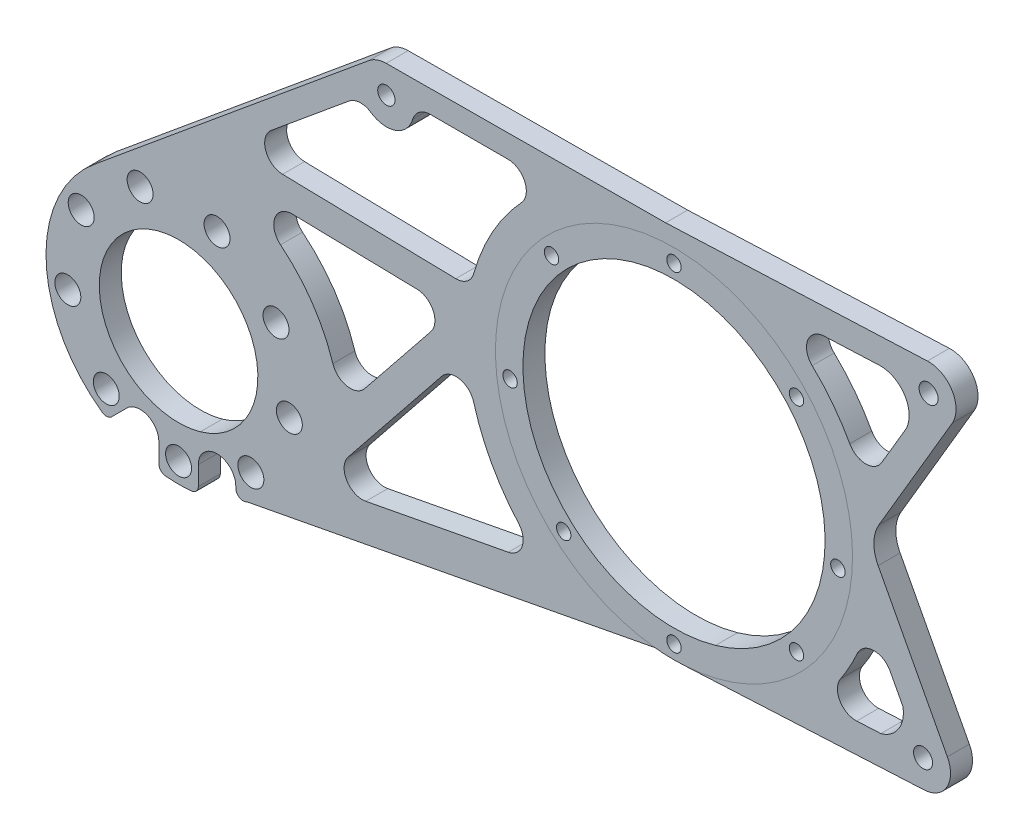
from build123d import *

# Parameters (mm, degrees)
SKETCH15_R          = 3.3
SKETCH15_R_2        = 2.5
SKETCH15_R_3        = 52.3875
SKETCH15_R_4        = 4.5
SKETCH15_R_5        = 27.4955
BOSS_EXTRUDE1_DEPTH = 7.62
SKETCH18_R          = 3.3
SKETCH18_R_2        = 3
PROFILE_DEPTH       = 804.110776731
PROF_FILLET_R       = 12.7
CUT_EXTRUDE2_DEPTH  = 784.912644787
FILLET2_R           = 6.35
CUT_EXTRUDE4_DEPTH  = 784.912644787
FILLET5_R           = 6.35


with BuildPart() as part:
    # Sketch15 → Boss-Extrude1 (new body)
    with BuildSketch(Plane(origin=(0, 0, 0), x_dir=(-1, 0, 0), z_dir=(0, 0, 1))):
        with BuildLine():
            ThreePointArc((-776.492771968, 151.978917225), (-781.907485254, 150.230614898), (-784.225, 145.034))
            Line((-784.225, 145.034), (-784.225, 0))
            ThreePointArc((-784.225, 0), (-782.179140867, -4.939140867), (-777.24, -6.985))
            Line((-777.24, -6.985), (-548.64, -6.985))
            ThreePointArc((-548.64, -6.985), (-545.651186694, -6.313257481), (-543.237237519, -4.427231931))
            Line((-543.237237519, -4.427231931), (-459.418508663, 97.860764379))
            ThreePointArc((-459.418508663, 97.860764379), (-449.426249212, 133.212914363), (-468.520845097, 164.597881552))
            ThreePointArc((-468.520845097, 164.597881552), (-470.201009111, 165.051242365), (-471.778645707, 164.316701751))
            Line((-471.778645707, 164.316701751), (-477.043529325, 159.051818133))
            ThreePointArc((-477.043529325, 159.051818133), (-484.127165713, 157.642795249), (-488.139723403, 163.648012211))
            Line((-488.139723403, 163.648012211), (-488.139723403, 170.220745001))
            ThreePointArc((-488.139723403, 170.220745001), (-488.796888696, 171.925600851), (-490.428332433, 172.748273949))
            ThreePointArc((-490.428332433, 172.748273949), (-494.978508993, 172.974), (-499.528685552, 172.748273949))
            ThreePointArc((-499.528685552, 172.748273949), (-501.160129289, 171.925600851), (-501.817294582, 170.220745001))
            Line((-501.817294582, 170.220745001), (-501.817294582, 163.648012211))
            ThreePointArc((-501.817294582, 163.648012211), (-508.317294582, 157.148012211), (-514.817294582, 163.648012211))
            Line((-514.817294582, 163.648012211), (-514.817294582, 164.225022653))
            ThreePointArc((-514.817294582, 164.225022653), (-516.106794745, 166.435870942), (-518.665995494, 166.401924563))
            Line((-518.665995494, 166.401924563), (-660.126842441, 139.458698233))
            Line((-660.126842441, 139.458698233), (-776.492771968, 151.978917225))
        make_face()
        with Locations((-777.24, 0)):
            Circle(SKETCH15_R, mode=Mode.SUBTRACT)
        with Locations((-709.220726776, 39.660663218)):
            Circle(SKETCH15_R_2, mode=Mode.SUBTRACT)
        with Locations((-666.75, 20.751477371)):
            Circle(SKETCH15_R_2, mode=Mode.SUBTRACT)
        with Locations((-624.279273224, 39.660663218)):
            Circle(SKETCH15_R_2, mode=Mode.SUBTRACT)
        with Locations((-666.75, 77.901477371)):
            Circle(SKETCH15_R_3, mode=Mode.SUBTRACT)
        with Locations((-548.64, 0)):
            Circle(SKETCH15_R, mode=Mode.SUBTRACT)
        with Locations((-723.58692632, 83.875279047)):
            Circle(SKETCH15_R_2, mode=Mode.SUBTRACT)
        with Locations((-709.220726776, 116.142291524)):
            Circle(SKETCH15_R_2, mode=Mode.SUBTRACT)
        with Locations((-628.509185847, 120.372204147)):
            Circle(SKETCH15_R_2, mode=Mode.SUBTRACT)
        with Locations((-777.24, 145.034)):
            Circle(SKETCH15_R, mode=Mode.SUBTRACT)
        with Locations((-666.75, 135.051477371)):
            Circle(SKETCH15_R_2, mode=Mode.SUBTRACT)
        with Locations((-609.91307368, 83.875279047)):
            Circle(SKETCH15_R_2, mode=Mode.SUBTRACT)
        with Locations((-508.317294582, 90.351987789)):
            Circle(SKETCH15_R_4, mode=Mode.SUBTRACT)
        with Locations((-481.639723403, 90.351987789)):
            Circle(SKETCH15_R_4, mode=Mode.SUBTRACT)
        with Locations((-528.75349974, 107.5)):
            Circle(SKETCH15_R_4, mode=Mode.SUBTRACT)
        with Locations((-494.978508993, 127)):
            Circle(SKETCH15_R_5, mode=Mode.SUBTRACT)
        with Locations((-461.203518245, 107.5)):
            Circle(SKETCH15_R_4, mode=Mode.SUBTRACT)
        with Locations((-533.38601136, 133.772278929)):
            Circle(SKETCH15_R_4, mode=Mode.SUBTRACT)
        with Locations((-456.571006625, 133.772278929)):
            Circle(SKETCH15_R_4, mode=Mode.SUBTRACT)
        with Locations((-520.04722577, 156.875733282)):
            Circle(SKETCH15_R_4, mode=Mode.SUBTRACT)
        with Locations((-494.978508993, 166)):
            Circle(SKETCH15_R_4, mode=Mode.SUBTRACT)
        with Locations((-469.909792215, 156.875733282)):
            Circle(SKETCH15_R_4, mode=Mode.SUBTRACT)
    extrude(amount=BOSS_EXTRUDE1_DEPTH)

    # Sketch18 → Profile (cut, through all)
    # profile 1 of 8: a face of its own
    with BuildSketch(Plane.XY.offset(7.62)):
        with BuildLine():
            Line((566.965511493, -10.583959195), (663.85291223, -10.018269525))
            Line((663.85291223, -10.018269525), (754.621654163, -6.144483643))
            ThreePointArc((754.621654163, -6.144483643), (763.192751251, -10.755823792), (763.238671737, -20.488554887))
            Line((763.238671737, -20.488554887), (734.216175486, -69.849260886))
            Line((734.216175486, -69.849260886), (761.531251005, -121.533364482))
            ThreePointArc((761.531251005, -121.533364482), (761.390077102, -130.692072661), (753.591596723, -135.496817122))
            Line((753.591596723, -135.496817122), (669.880378697, -139.734788664))
            ThreePointArc((669.880378697, -139.734788664), (664.998163099, -139.789187974), (660.126842441, -139.458698233))
            Line((660.126842441, -139.458698233), (776.492771968, -151.978917225))
            ThreePointArc((776.492771968, -151.978917225), (781.907485254, -150.230614898), (784.225, -145.034))
            Line((784.225, -145.034), (784.225, 0))
            ThreePointArc((784.225, 0), (782.179140867, 4.939140867), (777.24, 6.985))
            Line((777.24, 6.985), (548.64, 6.985))
            ThreePointArc((548.64, 6.985), (545.651186694, 6.313257481), (543.237237519, 4.427231931))
            Line((543.237237519, 4.427231931), (459.418508663, -97.860764379))
            ThreePointArc((459.418508663, -97.860764379), (462.395446423, -94.56617954), (465.676329874, -91.574148212))
            Line((465.676329874, -91.574148212), (560.95023003, -12.76918667))
            ThreePointArc((560.95023003, -12.76918667), (563.768843973, -11.156238391), (566.965511493, -10.583959195))
        make_face()
        with Locations((777.24, -145.034)):
            Circle(SKETCH18_R, mode=Mode.SUBTRACT)
        with Locations((548.64, 0)):
            Circle(SKETCH18_R, mode=Mode.SUBTRACT)
        with Locations((777.24, 0)):
            Circle(SKETCH18_R, mode=Mode.SUBTRACT)
    # profile 2 of 8: a face of its own
    with BuildSketch(Plane.XY.offset(7.62)):
        with BuildLine():
            Line((566.965511493, -10.583959195), (663.85291223, -10.018269525))
            Line((663.85291223, -10.018269525), (754.621654163, -6.144483643))
            ThreePointArc((754.621654163, -6.144483643), (763.192751251, -10.755823792), (763.238671737, -20.488554887))
            Line((763.238671737, -20.488554887), (734.216175486, -69.849260886))
            Line((734.216175486, -69.849260886), (761.531251005, -121.533364482))
            ThreePointArc((761.531251005, -121.533364482), (761.390077102, -130.692072661), (753.591596723, -135.496817122))
            Line((753.591596723, -135.496817122), (669.880378697, -139.734788664))
            ThreePointArc((669.880378697, -139.734788664), (664.998163099, -139.789187974), (660.126842441, -139.458698233))
            Line((660.126842441, -139.458698233), (776.492771968, -151.978917225))
            ThreePointArc((776.492771968, -151.978917225), (781.907485254, -150.230614898), (784.225, -145.034))
            Line((784.225, -145.034), (784.225, 0))
            ThreePointArc((784.225, 0), (782.179140867, 4.939140867), (777.24, 6.985))
            Line((777.24, 6.985), (548.64, 6.985))
            ThreePointArc((548.64, 6.985), (545.651186694, 6.313257481), (543.237237519, 4.427231931))
            Line((543.237237519, 4.427231931), (459.418508663, -97.860764379))
            ThreePointArc((459.418508663, -97.860764379), (462.395446423, -94.56617954), (465.676329874, -91.574148212))
            Line((465.676329874, -91.574148212), (560.95023003, -12.76918667))
            ThreePointArc((560.95023003, -12.76918667), (563.768843973, -11.156238391), (566.965511493, -10.583959195))
        make_face()
        with Locations((777.24, -145.034)):
            Circle(SKETCH18_R, mode=Mode.SUBTRACT)
        with Locations((548.64, 0)):
            Circle(SKETCH18_R, mode=Mode.SUBTRACT)
        with Locations((777.24, 0)):
            Circle(SKETCH18_R, mode=Mode.SUBTRACT)
    # profile 3 of 8: a face of its own
    with BuildSketch(Plane.XY.offset(7.62)):
        with BuildLine():
            Line((566.965511493, -10.583959195), (663.85291223, -10.018269525))
            Line((663.85291223, -10.018269525), (754.621654163, -6.144483643))
            ThreePointArc((754.621654163, -6.144483643), (763.192751251, -10.755823792), (763.238671737, -20.488554887))
            Line((763.238671737, -20.488554887), (734.216175486, -69.849260886))
            Line((734.216175486, -69.849260886), (761.531251005, -121.533364482))
            ThreePointArc((761.531251005, -121.533364482), (761.390077102, -130.692072661), (753.591596723, -135.496817122))
            Line((753.591596723, -135.496817122), (669.880378697, -139.734788664))
            ThreePointArc((669.880378697, -139.734788664), (664.998163099, -139.789187974), (660.126842441, -139.458698233))
            Line((660.126842441, -139.458698233), (776.492771968, -151.978917225))
            ThreePointArc((776.492771968, -151.978917225), (781.907485254, -150.230614898), (784.225, -145.034))
            Line((784.225, -145.034), (784.225, 0))
            ThreePointArc((784.225, 0), (782.179140867, 4.939140867), (777.24, 6.985))
            Line((777.24, 6.985), (548.64, 6.985))
            ThreePointArc((548.64, 6.985), (545.651186694, 6.313257481), (543.237237519, 4.427231931))
            Line((543.237237519, 4.427231931), (459.418508663, -97.860764379))
            ThreePointArc((459.418508663, -97.860764379), (462.395446423, -94.56617954), (465.676329874, -91.574148212))
            Line((465.676329874, -91.574148212), (560.95023003, -12.76918667))
            ThreePointArc((560.95023003, -12.76918667), (563.768843973, -11.156238391), (566.965511493, -10.583959195))
        make_face()
        with Locations((777.24, -145.034)):
            Circle(SKETCH18_R, mode=Mode.SUBTRACT)
        with Locations((548.64, 0)):
            Circle(SKETCH18_R, mode=Mode.SUBTRACT)
        with Locations((777.24, 0)):
            Circle(SKETCH18_R, mode=Mode.SUBTRACT)
    # profile 4 of 8: a face of its own
    with BuildSketch(Plane.XY.offset(7.62)):
        with BuildLine():
            Line((566.965511493, -10.583959195), (663.85291223, -10.018269525))
            Line((663.85291223, -10.018269525), (754.621654163, -6.144483643))
            ThreePointArc((754.621654163, -6.144483643), (763.192751251, -10.755823792), (763.238671737, -20.488554887))
            Line((763.238671737, -20.488554887), (734.216175486, -69.849260886))
            Line((734.216175486, -69.849260886), (761.531251005, -121.533364482))
            ThreePointArc((761.531251005, -121.533364482), (761.390077102, -130.692072661), (753.591596723, -135.496817122))
            Line((753.591596723, -135.496817122), (669.880378697, -139.734788664))
            ThreePointArc((669.880378697, -139.734788664), (664.998163099, -139.789187974), (660.126842441, -139.458698233))
            Line((660.126842441, -139.458698233), (776.492771968, -151.978917225))
            ThreePointArc((776.492771968, -151.978917225), (781.907485254, -150.230614898), (784.225, -145.034))
            Line((784.225, -145.034), (784.225, 0))
            ThreePointArc((784.225, 0), (782.179140867, 4.939140867), (777.24, 6.985))
            Line((777.24, 6.985), (548.64, 6.985))
            ThreePointArc((548.64, 6.985), (545.651186694, 6.313257481), (543.237237519, 4.427231931))
            Line((543.237237519, 4.427231931), (459.418508663, -97.860764379))
            ThreePointArc((459.418508663, -97.860764379), (462.395446423, -94.56617954), (465.676329874, -91.574148212))
            Line((465.676329874, -91.574148212), (560.95023003, -12.76918667))
            ThreePointArc((560.95023003, -12.76918667), (563.768843973, -11.156238391), (566.965511493, -10.583959195))
        make_face()
        with Locations((777.24, -145.034)):
            Circle(SKETCH18_R, mode=Mode.SUBTRACT)
        with Locations((548.64, 0)):
            Circle(SKETCH18_R, mode=Mode.SUBTRACT)
        with Locations((777.24, 0)):
            Circle(SKETCH18_R, mode=Mode.SUBTRACT)
    # profile 5 of 8: a face of its own
    with BuildSketch(Plane.XY.offset(7.62)):
        with BuildLine():
            Line((566.965511493, -10.583959195), (663.85291223, -10.018269525))
            Line((663.85291223, -10.018269525), (754.621654163, -6.144483643))
            ThreePointArc((754.621654163, -6.144483643), (763.192751251, -10.755823792), (763.238671737, -20.488554887))
            Line((763.238671737, -20.488554887), (734.216175486, -69.849260886))
            Line((734.216175486, -69.849260886), (761.531251005, -121.533364482))
            ThreePointArc((761.531251005, -121.533364482), (761.390077102, -130.692072661), (753.591596723, -135.496817122))
            Line((753.591596723, -135.496817122), (669.880378697, -139.734788664))
            ThreePointArc((669.880378697, -139.734788664), (664.998163099, -139.789187974), (660.126842441, -139.458698233))
            Line((660.126842441, -139.458698233), (776.492771968, -151.978917225))
            ThreePointArc((776.492771968, -151.978917225), (781.907485254, -150.230614898), (784.225, -145.034))
            Line((784.225, -145.034), (784.225, 0))
            ThreePointArc((784.225, 0), (782.179140867, 4.939140867), (777.24, 6.985))
            Line((777.24, 6.985), (548.64, 6.985))
            ThreePointArc((548.64, 6.985), (545.651186694, 6.313257481), (543.237237519, 4.427231931))
            Line((543.237237519, 4.427231931), (459.418508663, -97.860764379))
            ThreePointArc((459.418508663, -97.860764379), (462.395446423, -94.56617954), (465.676329874, -91.574148212))
            Line((465.676329874, -91.574148212), (560.95023003, -12.76918667))
            ThreePointArc((560.95023003, -12.76918667), (563.768843973, -11.156238391), (566.965511493, -10.583959195))
        make_face()
        with Locations((777.24, -145.034)):
            Circle(SKETCH18_R, mode=Mode.SUBTRACT)
        with Locations((548.64, 0)):
            Circle(SKETCH18_R, mode=Mode.SUBTRACT)
        with Locations((777.24, 0)):
            Circle(SKETCH18_R, mode=Mode.SUBTRACT)
    # profile 6 of 8: a face of its own
    with BuildSketch(Plane.XY.offset(7.62)):
        with Locations((755.027787962, -15.660821191)):
            Circle(SKETCH18_R)
    # profile 7 of 8: a face of its own
    with BuildSketch(Plane.XY.offset(7.62)):
        with Locations((567.021123494, -20.108796847)):
            Circle(SKETCH18_R_2)
    # profile 8 of 8: a face of its own
    with BuildSketch(Plane.XY.offset(7.62)):
        with Locations((753.11, -125.984)):
            Circle(SKETCH18_R)
    extrude(amount=-PROFILE_DEPTH, mode=Mode.SUBTRACT)

    # Prof Fillet
    prof_fillet_edges = [part.edges().sort_by_distance(p)[0] for p in [
        (734.216175486, -69.849260886, 3.81),
    ]]
    fillet(prof_fillet_edges, radius=PROF_FILLET_R)

    # Sketch19 → Cut-Extrude2 (cut, through all)
    with BuildSketch(Plane.XY.offset(7.62)):
        with BuildLine():
            Line((746.120366595, -114.117586287), (734.721949009, -92.550119087))
            ThreePointArc((734.721949009, -92.550119087), (727.751244155, -111.272374389), (715.744843377, -127.239838498))
            Line((715.744843377, -127.239838498), (738.462831206, -126.089715633))
            ThreePointArc((738.462831206, -126.089715633), (744.630372537, -121.59956212), (746.120366595, -114.117586287))
        make_face()
        with BuildLine():
            Line((732.48866001, -55.247622591), (747.151885785, -30.308789961))
            ThreePointArc((747.151885785, -30.308789961), (746.737777977, -20.36350464), (737.914666366, -15.755588962))
            Line((737.914666366, -15.755588962), (700.903841175, -17.335119636))
            ThreePointArc((700.903841175, -17.335119636), (720.172536614, -33.39528524), (732.48866001, -55.247622591))
        make_face()
    extrude(amount=-CUT_EXTRUDE2_DEPTH, mode=Mode.SUBTRACT)

    # Fillet2
    fillet2_edges = [part.edges().sort_by_distance(p)[0] for p in [
        (732.48866001, -55.247622591, 3.81),
        (700.903841175, -17.335119636, 3.81),
        (734.721949009, -92.550119087, 3.81),
        (715.744843377, -127.239838498, 3.81),
    ]]
    fillet(fillet2_edges, radius=FILLET2_R)

    # Sketch22 → Cut-Extrude4 (cut, through all)
    with BuildSketch(Plane.XY.offset(7.62)):
        with BuildLine():
            Line((621.388723544, -133.908618474), (542.982722013, -148.842154434))
            Line((542.982722013, -148.842154434), (594.94086334, -84.057218462))
            ThreePointArc((594.94086334, -84.057218462), (603.082763934, -111.679107661), (621.388723544, -133.908618474))
        make_face()
        with BuildLine():
            Line((576.368080274, -18.275760036), (626.262729302, -18.275760036))
            ThreePointArc((626.262729302, -18.275760036), (606.829410599, -37.851905313), (596.173225208, -63.294488764))
            Line((596.173225208, -63.294488764), (513.991419341, -61.499627151))
            Line((513.991419341, -61.499627151), (558.615624864, -24.58911132))
            ThreePointArc((558.615624864, -24.58911132), (570.212704132, -29.083173596), (576.368080274, -18.275760036))
        make_face()
        with BuildLine():
            Line((502.833975435, -71.418369914), (590.517562883, -73.333391171))
            Line((590.517562883, -73.333391171), (550.94559886, -122.674400877))
            ThreePointArc((550.94559886, -122.674400877), (535.906798121, -88.582541664), (502.833975435, -71.418369914))
        make_face()
    extrude(amount=-CUT_EXTRUDE4_DEPTH, mode=Mode.SUBTRACT)

    # Fillet5
    fillet5_edges = [part.edges().sort_by_distance(p)[0] for p in [
        (576.368080274, -18.275760036, 3.81),
        (626.262729302, -18.275760036, 3.81),
        (596.173225208, -63.294488764, 3.81),
        (513.991419341, -61.499627151, 3.81),
        (558.615624864, -24.58911132, 3.81),
        (621.388723544, -133.908618474, 3.81),
        (542.982722013, -148.842154434, 3.81),
        (594.94086334, -84.057218462, 3.81),
        (502.833975435, -71.418369914, 3.81),
        (590.517562883, -73.333391171, 3.81),
        (550.94559886, -122.674400877, 3.81),
    ]]
    fillet(fillet5_edges, radius=FILLET5_R)


solid = part.part
